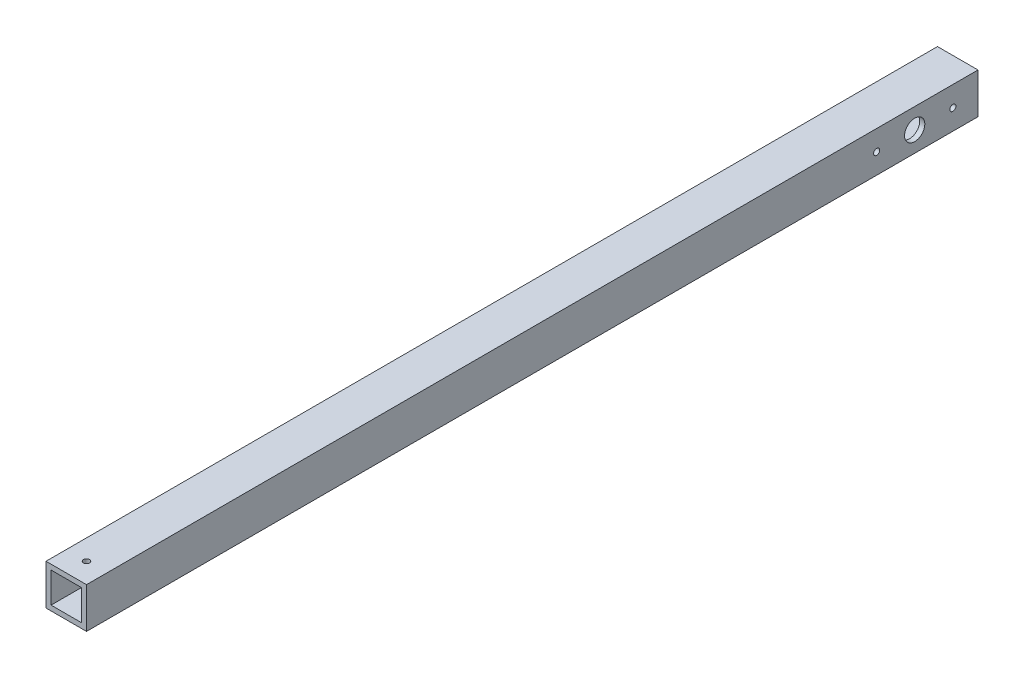
from build123d import *

# Parameters (mm, degrees)
SKETCH1_W           = 25.4
SKETCH1_H           = 25.4
SKETCH1_W_2         = 19.05
SKETCH1_H_2         = 19.05
BOSS_EXTRUDE1_DEPTH = 279.4
SKETCH7_R           = 1.905
CUT_EXTRUDE1_DEPTH  = 281.839473721
SKETCH8_R           = 1.905
SKETCH8_R_2         = 6.35
CUT_EXTRUDE2_DEPTH  = 281.839473721


with BuildPart() as part:
    # Sketch1 → Boss-Extrude1 (new, symmetric)
    with BuildSketch(Plane.XY):
        Rectangle(SKETCH1_W, SKETCH1_H)
        Rectangle(SKETCH1_W_2, SKETCH1_H_2, mode=Mode.SUBTRACT)
    extrude(amount=BOSS_EXTRUDE1_DEPTH, both=True)

    # Sketch7 → Cut-Extrude1 (cut, through all)
    with BuildSketch(Plane(origin=(0, 12.7, 0), x_dir=(1, 0, 0), z_dir=(0, 1, 0))):
        with Locations(Location((0, -266.7, 0), (0, 0, 270))):
            Circle(SKETCH7_R)
    extrude(amount=-CUT_EXTRUDE1_DEPTH, mode=Mode.SUBTRACT)

    # Sketch8 → Cut-Extrude2 (cut, through all)
    with BuildSketch(Plane(origin=(12.7, 0, 0), x_dir=(0, 0, -1), z_dir=(1, 0, 0))):
        with Locations(Location((215.9, 0, 0), (0, 0, 90))):
            Circle(SKETCH8_R)
        with Locations(Location((263.652, 0, 0), (0, 0, 90))):
            Circle(SKETCH8_R)
        with Locations(Location((239.7125, 0, 0), (0, 0, 90))):
            Circle(SKETCH8_R_2)
    extrude(amount=-CUT_EXTRUDE2_DEPTH, mode=Mode.SUBTRACT)


solid = part.part
